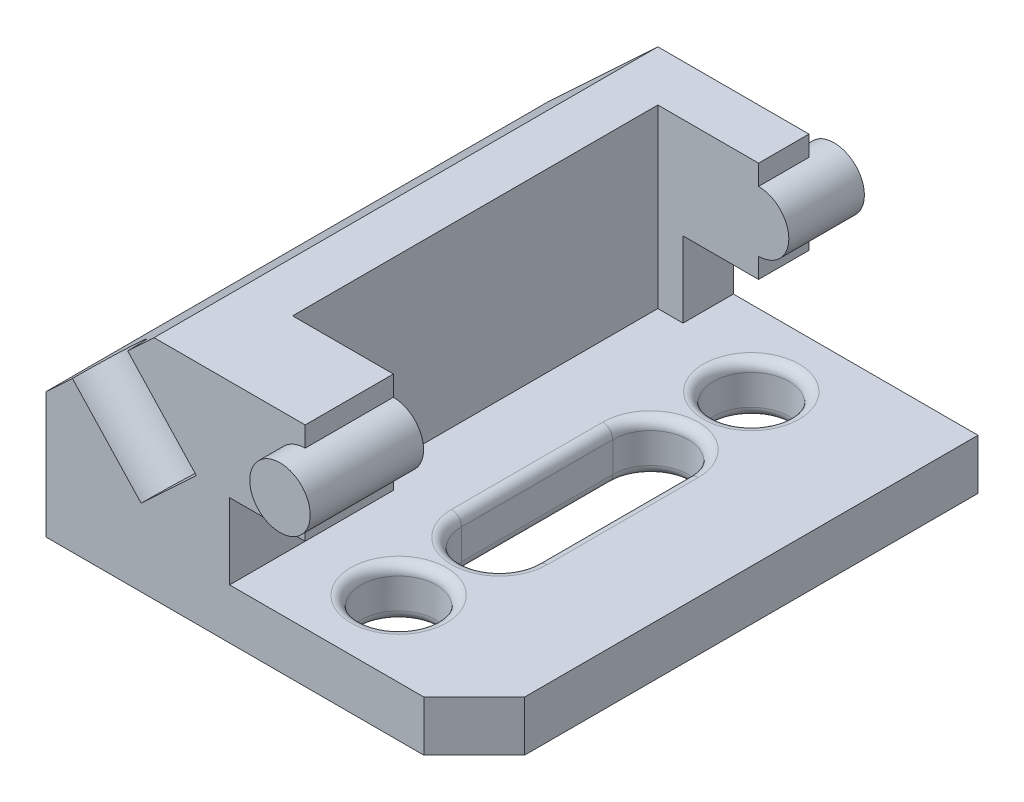
from build123d import *

# Parameters (mm, degrees)
BOSS_EXTRU_1_DEPTH      = 50
BOSS_EXTRU_2_DEPTH      = 55
BOSS_EXTRU_2_DEPTH_BACK = 55
ESQUISSE3_R             = 6
ESQUISSE4_W             = 26
ESQUISSE4_H             = 72.5
ENL_V_MAT_EXTRU_1_DEPTH = 35
ESQUISSE5_R             = 7.5
ENL_V_MAT_EXTRU_2_DEPTH = 20
ESQUISSE8_R             = 7.5
ENL_V_MAT_EXTRU_3_DEPTH = 108.121426428
CONG_1_R                = 2
CONG_2_R                = 2
CHANFREIN3_SIZE         = 10


with BuildPart() as part:
    # Esquisse1 → Boss.-Extru.1 (new, symmetric)
    with BuildSketch(Plane.XY):
        Polygon((0, 0), (0, 25), (21.4473742, 45), (51.4473742, 45), (51.4473742, 25), (36.4473742, 25), (36.4473742, 10), (85, 10), (85, 0), align=None)
    extrude(amount=BOSS_EXTRU_1_DEPTH, both=True)

    # Esquisse3 → Boss.-Extru.2 (add, two sides: drawn at the far end of the back side and taken through both)
    with BuildSketch(Plane.XY.offset(-BOSS_EXTRU_2_DEPTH_BACK)):
        with Locations((51.4473742, 35)):
            Circle(ESQUISSE3_R)
    extrude(amount=BOSS_EXTRU_2_DEPTH + BOSS_EXTRU_2_DEPTH_BACK)

    # Esquisse4 → Enlèv. mat.-Extru.1 (cut)
    with BuildSketch(Plane(origin=(0, 45, 0), x_dir=(1, 0, 0), z_dir=(0, 1, 0))):
        with Locations((44.4473742, 3.75)):
            Rectangle(ESQUISSE4_W, ESQUISSE4_H)
    extrude(amount=-ENL_V_MAT_EXTRU_1_DEPTH, mode=Mode.SUBTRACT)

    # Esquisse5 → Enlèv. mat.-Extru.2 (cut)
    with BuildSketch(Plane(origin=(-12.469550628, 13.371955922, 0), x_dir=(0.7313537016191717, 0.6819983600624974, 0), z_dir=(-0.6819983600624974, 0.7313537016191717, 0))):
        with Locations((31.712750858, -50)):
            Circle(ESQUISSE5_R)
    extrude(amount=-ENL_V_MAT_EXTRU_2_DEPTH, mode=Mode.SUBTRACT)

    # Esquisse8 → Enlèv. mat.-Extru.3 (cut, through all)
    with BuildSketch(Plane(origin=(0, 10, 0), x_dir=(1, 0, 0), z_dir=(0, 1, 0))):
        with Locations(Location((55, -35, 0), (0, 0, 180))):
            Circle(ESQUISSE8_R)
        with Locations(Location((55, 35, 0), (0, 0, 180))):
            Circle(ESQUISSE8_R)
        with BuildLine():
            Line((62.5, 15), (62.5, -15))
            ThreePointArc((62.5, -15), (55, -22.5), (47.5, -15))
            Line((47.5, -15), (47.5, 15))
            ThreePointArc((47.5, 15), (55, 22.5), (62.5, 15))
        make_face()
    extrude(amount=-ENL_V_MAT_EXTRU_3_DEPTH, mode=Mode.SUBTRACT)

    # Congé1
    cong_1_edges = [part.edges().sort_by_distance(p)[0] for p in [
        (55, 0, -22.5),
        (62.5, 0, 0),
        (55, 0, 22.5),
        (47.5, 0, 0),
        (55, 10, -22.5),
        (47.5, 10, 0),
        (55, 10, 22.5),
        (62.5, 10, 0),
    ]]
    fillet(cong_1_edges, radius=CONG_1_R)

    # Congé2
    cong_2_edges = [part.edges().sort_by_distance(p)[0] for p in [
        (62.5, 0, -35),
        (62.5, 10, -35),
        (62.5, 0, 35),
        (62.5, 10, 35),
    ]]
    fillet(cong_2_edges, radius=CONG_2_R)

    # Chanfrein3
    chanfrein3_edges = [part.edges().sort_by_distance(p)[0] for p in [
        (85, 5, 50),
    ]]
    chamfer(chanfrein3_edges, length=CHANFREIN3_SIZE)


solid = part.part
